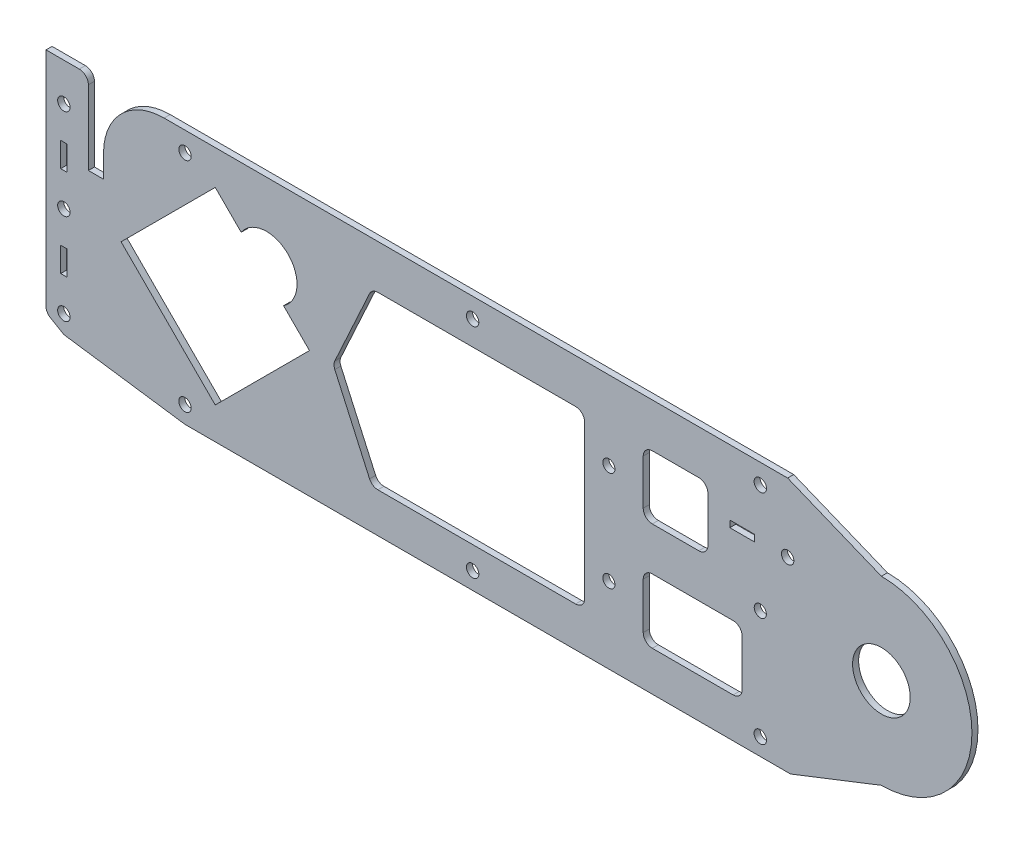
from build123d import *

# Parameters (mm, degrees)
SKETCH_1_R      = 2.05
SKETCH_1_W      = 2.1
SKETCH_1_H      = 8.1
SKETCH_1_R_2    = 2
SKETCH_1_R_3    = 9.525
SKETCH_1_W_2    = 21.362756018
SKETCH_1_H_2    = 20.918096029
SKETCH_1_W_3    = 8.2
SKETCH_1_H_3    = 2.2
EXTRUDE_1_DEPTH = 2
FILLET_1_R      = 3
FILLET_2_R      = 20
FILLET_4_R      = 3


with BuildPart() as part:
    # 草图1 → 凸台-拉伸1 (new body)
    with BuildSketch(Plane.XY):
        with BuildLine():
            Line((240.542857143, -41.815743938), (270.542857143, -30.045714286))
            ThreePointArc((270.542857143, -30.045714286), (300.442857143, -0.145714286), (270.542857143, 29.754285714))
            Line((270.542857143, 29.754285714), (239.574018739, 42.359033922))
            Line((239.574018739, 42.359033922), (13.642857143, 42.359033922))
            Line((13.642857143, 42.359033922), (13.642857143, 14.854285714))
            Line((13.642857143, 14.854285714), (8.642857143, 14.854285714))
            Line((8.642857143, 14.854285714), (8.642857143, 42.359033922))
            Line((8.642857143, 42.359033922), (-5.357142857, 42.359033922))
            Line((-5.357142857, 42.359033922), (-5.357142857, -32.689201643))
            Line((-5.357142857, -32.689201643), (0.542857143, -36.145714286))
            Line((0.542857143, -36.145714286), (40.542857143, -41.815743938))
            Line((40.542857143, -41.815743938), (240.542857143, -41.815743938))
        make_face()
        with Locations((40.542857143, -36.145714286)):
            Circle(SKETCH_1_R, mode=Mode.SUBTRACT)
        with Locations((0.542857143, -30.145714286)):
            Circle(SKETCH_1_R, mode=Mode.SUBTRACT)
        with Locations((135.542857143, -36.145714286)):
            Circle(SKETCH_1_R, mode=Mode.SUBTRACT)
        with Locations((0.542857143, -15.145714286)):
            Rectangle(SKETCH_1_W, SKETCH_1_H, mode=Mode.SUBTRACT)
        with Locations((0.542857143, -0.145714286)):
            Circle(SKETCH_1_R, mode=Mode.SUBTRACT)
        with BuildLine():
            Line((50.542857143, 30.966984086), (59.099206329, 22.4106349))
            ThreePointArc((59.099206329, 22.4106349), (74.584487703, 23.895916275), (73.099206329, 8.4106349))
            Line((73.099206329, 8.4106349), (81.655555515, -0.145714286))
            Line((81.655555515, -0.145714286), (50.542857143, -31.258412658))
            Line((50.542857143, -31.258412658), (19.430158771, -0.145714286))
            Line((19.430158771, -0.145714286), (50.542857143, 30.966984086))
        make_face(mode=Mode.SUBTRACT)
        Polygon((102.300999077, -28.676695157), (89.464558906, -0.145714286), (102.300999077, 27.804285714), (172.548041202, 27.804285714), (172.548041202, -28.676695157), align=None, mode=Mode.SUBTRACT)
        with Locations((230.542857143, -36.145714286)):
            Circle(SKETCH_1_R, mode=Mode.SUBTRACT)
        with Locations((180.542857143, -16.645714286)):
            Circle(SKETCH_1_R_2, mode=Mode.SUBTRACT)
        Polygon((224.574018739, -28.676695157), (213.241022587, -28.676695157), (191.878266569, -28.676695157), (191.878266569, -7.415485794), (224.574018739, -7.415485794), align=None, mode=Mode.SUBTRACT)
        with Locations((230.542857143, -0.145714286)):
            Circle(SKETCH_1_R_2, mode=Mode.SUBTRACT)
        with Locations((270.542857143, -0.145714286)):
            Circle(SKETCH_1_R_3, mode=Mode.SUBTRACT)
        with Locations((0.542857143, 14.854285714)):
            Rectangle(SKETCH_1_W, SKETCH_1_H, mode=Mode.SUBTRACT)
        with Locations((0.542857143, 29.854285714)):
            Circle(SKETCH_1_R, mode=Mode.SUBTRACT)
        with Locations((40.542857143, 35.854285714)):
            Circle(SKETCH_1_R, mode=Mode.SUBTRACT)
        with Locations((135.542857143, 35.854285714)):
            Circle(SKETCH_1_R, mode=Mode.SUBTRACT)
        with Locations((180.542857143, 16.354285714)):
            Circle(SKETCH_1_R_2, mode=Mode.SUBTRACT)
        with Locations((202.559644578, 17.3452377)):
            Rectangle(SKETCH_1_W_2, SKETCH_1_H_2, mode=Mode.SUBTRACT)
        with Locations((224.574018739, 19.704285714)):
            Rectangle(SKETCH_1_W_3, SKETCH_1_H_3, mode=Mode.SUBTRACT)
        with Locations((239.574018739, 19.704285714)):
            Circle(SKETCH_1_R, mode=Mode.SUBTRACT)
        with Locations((230.542857143, 35.854285714)):
            Circle(SKETCH_1_R, mode=Mode.SUBTRACT)
    extrude(amount=EXTRUDE_1_DEPTH)

    # 圆角1
    fillet_1_edges = [part.edges().sort_by_distance(p)[0] for p in [
        (224.574018739, -7.415485794, 1),
        (191.878266569, -7.415485794, 1),
        (191.878266569, -28.676695157, 1),
        (224.574018739, -28.676695157, 1),
        (172.548041202, -28.676695157, 1),
        (172.548041202, 27.804285714, 1),
        (102.300999077, 27.804285714, 1),
        (89.464558906, -0.145714286, 1),
        (102.300999077, -28.676695157, 1),
        (191.878266569, 27.804285714, 1),
        (191.878266569, 6.886189685, 1),
        (213.241022587, 6.886189685, 1),
        (213.241022587, 27.804285714, 1),
    ]]
    fillet(fillet_1_edges, radius=FILLET_1_R)

    # 圆角2
    fillet_2_edges = [part.edges().sort_by_distance(p)[0] for p in [
        (13.642857143, 42.359033922, 1),
    ]]
    fillet(fillet_2_edges, radius=FILLET_2_R)

    # 圆角4
    fillet_4_edges = [part.edges().sort_by_distance(p)[0] for p in [
        (40.542857143, -41.815743938, 1),
        (0.542857143, -36.145714286, 1),
        (-5.357142857, -32.689201643, 1),
        (8.642857143, 42.359033922, 1),
    ]]
    fillet(fillet_4_edges, radius=FILLET_4_R)


solid = part.part
